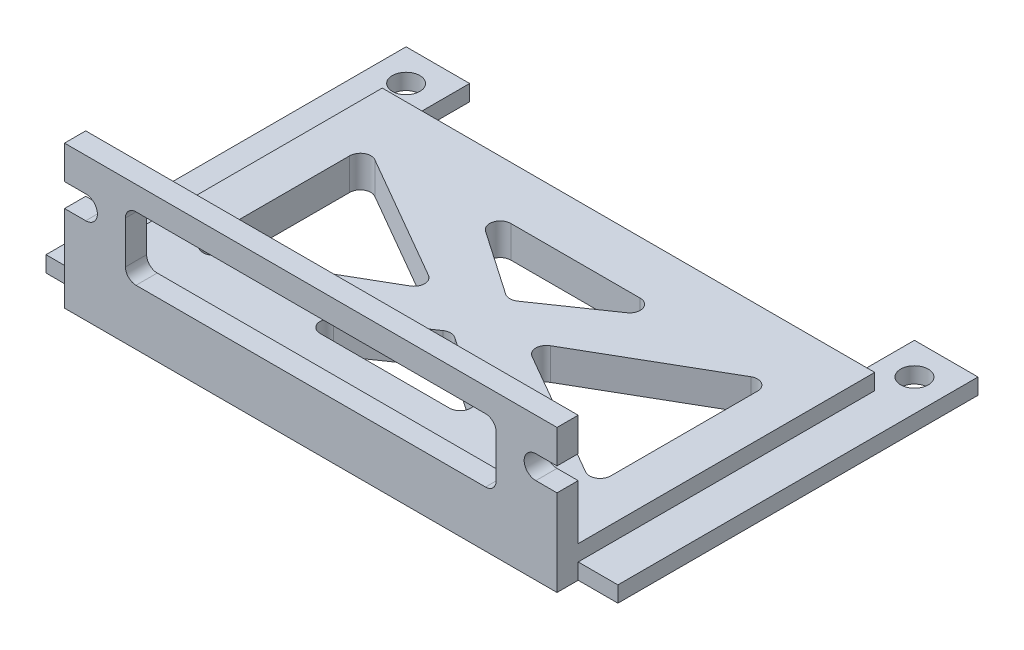
from build123d import *

# Parameters (mm, degrees)
SKETCH_1_W          = 116
SKETCH_1_H          = 56
EXTRUDE_1_DEPTH     = 3
SKETCH_2_W          = 93
SKETCH_2_H          = 56
EXTRUDE_2_DEPTH     = 3
SKETCH_3_W          = 93
SKETCH_3_H          = 27
EXTRUDE_3_DEPTH     = 4
SKETCH_5_W          = 12
SKETCH_5_H          = 12
EXTRUDE_4_DEPTH     = 3
SKETCH_6_R          = 2.6
CUT_EXTRUDE_1_DEPTH = 3
CUT_EXTRUDE_2_DEPTH = 74.518705103
SKETCH_8_W          = 70
SKETCH_8_H          = 12
CUT_EXTRUDE_3_DEPTH = 94.364875622
SKETCH_9_W          = 4
SKETCH_9_H          = 3
CUT_EXTRUDE_4_DEPTH = 88.709748603
CUT_EXTRUDE_5_DEPTH = 91.93404203
FILLET_1_R          = 2


with BuildPart() as part:
    # 草图1 → 凸台-拉伸1 (new body)
    with BuildSketch(Plane(origin=(0, 0, 0), x_dir=(1, 0, 0), z_dir=(0, 1, 0))):
        Rectangle(SKETCH_1_W, SKETCH_1_H)
    extrude(amount=EXTRUDE_1_DEPTH)

    # 草图2 → 凸台-拉伸2 (add)
    with BuildSketch(Plane(origin=(0, 3, 0), x_dir=(1, 0, 0), z_dir=(0, 1, 0))):
        Rectangle(SKETCH_2_W, SKETCH_2_H)
    extrude(amount=EXTRUDE_2_DEPTH)

    # 草图3 → 凸台-拉伸3 (add)
    with BuildSketch(Plane.XY.offset(28)):
        with Locations((0, 13.5)):
            Rectangle(SKETCH_3_W, SKETCH_3_H)
    extrude(amount=EXTRUDE_3_DEPTH)

    # 草图5 → 凸台-拉伸4 (add)
    with BuildSketch(Plane(origin=(0, 3, 0), x_dir=(1, 0, 0), z_dir=(0, 1, 0))):
        with Locations((48, 34)):
            Rectangle(SKETCH_5_W, SKETCH_5_H)
        with Locations((-48, 34)):
            Rectangle(SKETCH_5_W, SKETCH_5_H)
    extrude(amount=-EXTRUDE_4_DEPTH)

    # 草图6 → 切除-拉伸1 (cut)
    with BuildSketch(Plane(origin=(0, 3, 0), x_dir=(1, 0, 0), z_dir=(0, 1, 0))):
        with Locations(Location((-48, 34, 0), (0, 0, 270))):
            Circle(SKETCH_6_R)
        with Locations(Location((48, 34, 0), (0, 0, 270))):
            Circle(SKETCH_6_R)
    extrude(amount=-CUT_EXTRUDE_1_DEPTH, mode=Mode.SUBTRACT)

    # 草图7 → 切除-拉伸2 (cut, through all)
    with BuildSketch(Plane(origin=(0, 6, 0), x_dir=(1, 0, 0), z_dir=(0, 1, 0))):
        Polygon((-18.64631219, 18), (0, 5.160153957), (18.64631219, 18), align=None)
        Polygon((-8.5, 0), (-38.5, 17.320508076), (-38.5, -17.320508076), align=None)
        Polygon((38.5, -17.320508076), (8.5, 0), (38.5, 17.320508076), align=None)
        Polygon((-18.64631219, -18), (18.64631219, -18), (0, -5.160153957), align=None)
    extrude(amount=-CUT_EXTRUDE_2_DEPTH, mode=Mode.SUBTRACT)

    # 草图8 → 切除-拉伸3 (cut, through all)
    with BuildSketch(Plane(origin=(0, 0, 28), x_dir=(-1, 0, 0), z_dir=(0, 0, -1))):
        with Locations((0, 16.5)):
            Rectangle(SKETCH_8_W, SKETCH_8_H)
    extrude(amount=-CUT_EXTRUDE_3_DEPTH, mode=Mode.SUBTRACT)

    # 草图9 → 切除-拉伸4 (cut, through all)
    with BuildSketch(Plane(origin=(0, 0, -28), x_dir=(-1, 0, 0), z_dir=(0, 0, -1))):
        with Locations((56, 1.5)):
            Rectangle(SKETCH_9_W, SKETCH_9_H)
        with Locations((-56, 1.5)):
            Rectangle(SKETCH_9_W, SKETCH_9_H)
    extrude(amount=-CUT_EXTRUDE_4_DEPTH, mode=Mode.SUBTRACT)

    # 草图10 → 切除-拉伸5 (cut, through all)
    with BuildSketch(Plane(origin=(0, 0, 28), x_dir=(-1, 0, 0), z_dir=(0, 0, -1))):
        with BuildLine():
            Line((-46.5, 20.7), (-42.5, 20.7))
            ThreePointArc((-42.5, 20.7), (-40.3, 18.5), (-42.5, 16.3))
            Line((-42.5, 16.3), (-46.5, 16.3))
            ThreePointArc((-46.5, 16.3), (-48.7, 18.5), (-46.5, 20.7))
        make_face()
        with BuildLine():
            Line((46.5, 20.7), (42.5, 20.7))
            ThreePointArc((42.5, 20.7), (40.3, 18.5), (42.5, 16.3))
            Line((42.5, 16.3), (46.5, 16.3))
            ThreePointArc((46.5, 16.3), (48.7, 18.5), (46.5, 20.7))
        make_face()
    extrude(amount=-CUT_EXTRUDE_5_DEPTH, mode=Mode.SUBTRACT)

    # 圆角1
    fillet_1_edges = [part.edges().sort_by_distance(p)[0] for p in [
        (0, 3, -5.160153957),
        (-18.64631219, 3, -18),
        (-18.64631219, 3, 18),
        (0, 3, 5.160153957),
        (18.64631219, 3, 18),
        (-8.5, 3, 0),
        (-38.5, 3, 17.320508076),
        (-38.5, 3, -17.320508076),
        (-35, 22.5, 30),
        (-35, 10.5, 30),
        (35, 10.5, 30),
        (35, 22.5, 30),
        (38.5, 3, -17.320508076),
        (38.5, 3, 17.320508076),
        (8.5, 3, 0),
        (18.64631219, 3, -18),
    ]]
    fillet(fillet_1_edges, radius=FILLET_1_R)


solid = part.part
